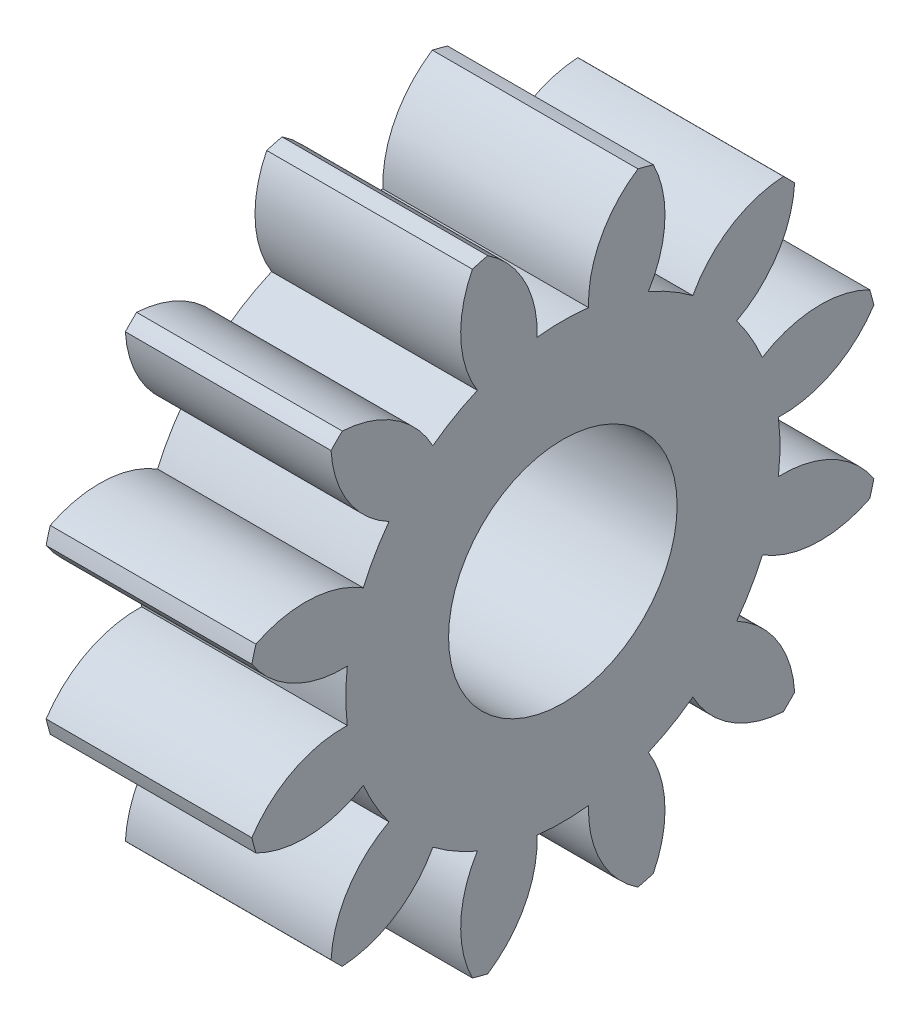
from build123d import *

# Parameters (mm, degrees)
BASPROSKE_W     = 4.5
BASPROSKE_H     = 7
TOOTHCUT_DEPTH  = 11.874281585
TEETHCUTS_COUNT = 12
TEETHCUTS_ANGLE = 330
BORSKE_R        = 2.5
BORE_DEPTH      = 50.0000508


with BuildPart() as part:
    # BasProSke → Base-Revolve (revolve)
    with BuildSketch(Plane(origin=(0, 0, 0), x_dir=(1, 0, 0), z_dir=(0, 1, 0)), mode=Mode.PRIVATE) as base_revolve_sk:
        with Locations((2.25, 3.5)):
            Rectangle(BASPROSKE_W, BASPROSKE_H)
    revolve(base_revolve_sk.sketch.rotate(Axis((-10, 0, 0), (1, 0, 0)), 180), axis=Axis((-10, 0, 0), (1, 0, 0)))

    # TooCutSke → ToothCut (cut, through all)
    with BuildSketch(Plane(origin=(0, 0, 0), x_dir=(0, 0, -1), z_dir=(1, 0, 0))):
        with BuildLine():
            ThreePointArc((0.562207301, 4.715604304), (0, 4.749), (-0.562207301, 4.715604304))
            ThreePointArc((-0.562207301, 4.715604304), (-0.837528627, 5.917009812), (-1.672850686, 6.823328788))
            ThreePointArc((-1.672850686, 6.823328788), (0, 7.0254), (1.672850686, 6.823328788))
            ThreePointArc((1.672850686, 6.823328788), (0.837528627, 5.917009812), (0.562207301, 4.715604304))
        make_face()
    toothcut = extrude(amount=TOOTHCUT_DEPTH, mode=Mode.SUBTRACT)

    # TeethCuts: ToothCut ×12 about axis
    teethcuts_axis = Axis((-10, 0, 0), (1, 0, 0))
    for i in range(1, TEETHCUTS_COUNT):
        add(toothcut.rotate(teethcuts_axis, i * TEETHCUTS_ANGLE / (TEETHCUTS_COUNT - 1)), mode=Mode.SUBTRACT)

    # BorSke → Bore (cut, symmetric)
    with BuildSketch(Plane(origin=(0, 0, 0), x_dir=(0, 0, -1), z_dir=(1, 0, 0))):
        with Locations(Location((0, 0, 0), (0, 0, 180))):
            Circle(BORSKE_R)
    extrude(amount=BORE_DEPTH, both=True, mode=Mode.SUBTRACT)


solid = part.part
